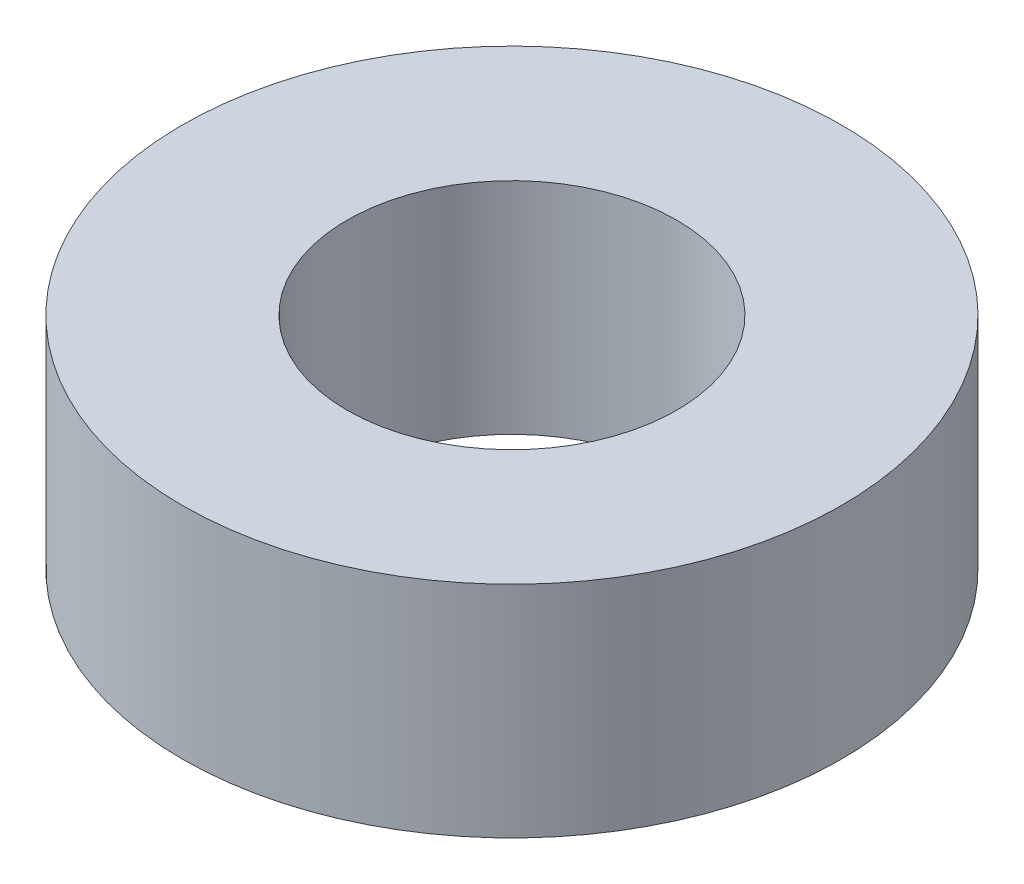
from build123d import *

# Parameters (mm, degrees)
SKETCH_1_R          = 3
EXTRUDE_1_DEPTH     = 2
SKETCH_3_R          = 1.5
CUT_EXTRUDE_1_DEPTH = 18.806298289


with BuildPart() as part:
    # 草图1 → 凸台-拉伸1 (new body)
    with BuildSketch(Plane(origin=(0, 0, 0), x_dir=(1, 0, 0), z_dir=(0, 1, 0))):
        with Locations(Location((-10.664303985, 8.240598534, 0), (0, 0, 270))):
            Circle(SKETCH_1_R)
    extrude(amount=EXTRUDE_1_DEPTH)

    # 草图3 → 切除-拉伸1 (cut, through all)
    with BuildSketch(Plane(origin=(0, 0, 0), x_dir=(1, 0, 0), z_dir=(0, 1, 0))):
        with Locations(Location((-10.664303985, 8.240598534, 0), (0, 0, 270))):
            Circle(SKETCH_3_R)
    extrude(amount=CUT_EXTRUDE_1_DEPTH, mode=Mode.SUBTRACT)


solid = part.part
